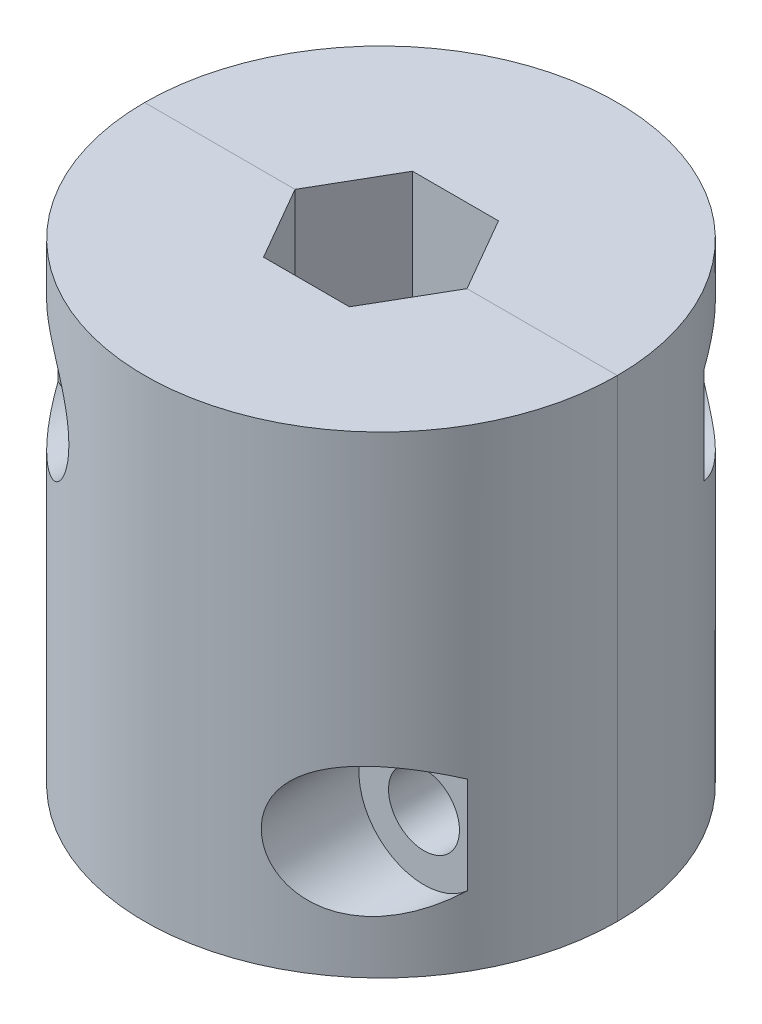
from build123d import *

# Parameters (mm, degrees)
BOSS_EXTRUDE1_DEPTH = 10
BOSS_EXTRUDE2_DEPTH = 10
SKETCH2_R           = 1.4999999999999998
CUT_EXTRUDE4_DEPTH  = 15
SKETCH2_5_R         = 2.75
SKETCH2_5_R_2       = 1.4999999999999998
CUT_EXTRUDE10_DEPTH = 5
CUT_EXTRUDE13_START = -20
SKETCH2_9_R         = 1.4999999999999998
CUT_EXTRUDE13_DEPTH = 15
CUT_EXTRUDE11_START = -20
SKETCH2_6_R         = 2.75
SKETCH2_6_R_2       = 1.4999999999999998
CUT_EXTRUDE11_DEPTH = 5
SKETCH1_5_W         = 20
SKETCH1_5_H         = 20
CUT_EXTRUDE9_DEPTH  = 10


with BuildPart() as part:
    # Sketch1 → Boss-Extrude1 (new, symmetric)
    with BuildSketch(Plane(origin=(0, 0, 0), x_dir=(1, 0, 0), z_dir=(0, 1, 0))):
        with BuildLine():
            Line((1.8186533479473221, 3.150000000000001), (3.6373066958946447, 0))
            Line((3.6373066958946447, 0), (10, 0))
            ThreePointArc((10, 0), (7.071067802431099, 7.0710678212998515), (-2.668444515e-08, 10))
            ThreePointArc((-2.668444515e-08, 10), (-7.071067821299852, 7.071067802431098), (-10, 1.22e-15))
            Line((-10, 0), (-3.637306695894643, 8.7e-16))
            Line((-3.637306695894643, 8.9e-16), (-1.8186533479473208, 3.1500000000000012))
            Line((-1.8186533479473206, 3.1500000000000012), (1.8186533479473224, 3.150000000000001))
        make_face()
        with BuildLine():
            ThreePointArc((-2.668444515e-08, 10), (7.071067802431099, 7.0710678212998515), (10, 0))
            Line((10, 0), (10, 10))
            Line((10, 10), (-2.668444488e-08, 10))
        make_face()
        with BuildLine():
            ThreePointArc((-10, 1.22e-15), (-7.071067821299852, 7.071067802431098), (-2.668444515e-08, 10))
            Line((-2.668444488e-08, 10), (-10, 10))
            Line((-10, 10), (-10, 0))
        make_face()
    extrude(amount=BOSS_EXTRUDE1_DEPTH, both=True)


with BuildPart() as body_2:
    # Sketch1<3> → Boss-Extrude2 (new, symmetric)
    with BuildSketch(Plane(origin=(0, 0, 0), x_dir=(1, 0, 0), z_dir=(0, 1, 0))):
        with BuildLine():
            Line((10, 0), (3.6373066958946447, 0))
            Line((3.6373066958946447, 0), (1.8186533479473237, -3.15))
            Line((1.8186533479473235, -3.15), (-1.8186533479473204, -3.15))
            Line((-1.8186533479473204, -3.15), (-3.637306695894643, 8.7e-16))
            Line((-3.637306695894643, 8.7e-16), (-10, 0))
            ThreePointArc((-10, 1.22e-15), (-7.071067811865477, -7.071067811865475), (-1.84e-15, -10))
            ThreePointArc((-1.84e-15, -10), (7.071067811865474, -7.071067811865477), (10, -2.45e-15))
        make_face()
        with BuildLine():
            Line((10, -10), (10, 0))
            ThreePointArc((10, -2.45e-15), (7.071067811865474, -7.071067811865477), (-1.84e-15, -10))
            Line((-1.78e-15, -10), (10, -10))
        make_face()
        with BuildLine():
            Line((-10, -10), (-1.78e-15, -10))
            ThreePointArc((-1.84e-15, -10), (-7.071067811865477, -7.071067811865475), (-10, 1.22e-15))
            Line((-10, 0), (-10, -10))
        make_face()
    extrude(amount=BOSS_EXTRUDE2_DEPTH, both=True)


with BuildPart() as cut_extrude4_tool:
    # Sketch2 → Cut-Extrude4 (new body)
    with BuildSketch(Plane(origin=(0, 0, -10), x_dir=(-1, 0, 0), z_dir=(0, 0, -1))):
        with Locations((-6.818653347947323, 5)):
            Circle(SKETCH2_R)
        with Locations((6.818653347947323, -5)):
            Circle(SKETCH2_R)
    extrude(amount=-CUT_EXTRUDE4_DEPTH)


with BuildPart() as part_1:
    add(part.part)

    # Cut-Extrude4: cut by cut_extrude4_tool
    add(cut_extrude4_tool.part, mode=Mode.SUBTRACT)

    # Sketch2<5> → Cut-Extrude10 (cut)
    # profile 1 of 2: a face of its own
    with BuildSketch(Plane(origin=(0, 0, -10), x_dir=(-1, 0, 0), z_dir=(0, 0, -1))):
        with Locations((-6.818653347947323, 5)):
            Circle(SKETCH2_5_R)
        with Locations((-6.818653347947323, 5)):
            Circle(SKETCH2_5_R_2, mode=Mode.SUBTRACT)
    # profile 2 of 2: a face of its own
    with BuildSketch(Plane(origin=(0, 0, -10), x_dir=(-1, 0, 0), z_dir=(0, 0, -1))):
        with Locations((6.818653347947323, -5)):
            Circle(SKETCH2_5_R)
        with Locations((6.818653347947323, -5)):
            Circle(SKETCH2_5_R_2, mode=Mode.SUBTRACT)
    extrude(amount=-CUT_EXTRUDE10_DEPTH, mode=Mode.SUBTRACT)


with BuildPart() as body_2_1:
    add(body_2.part)

    # Cut-Extrude4: cut by cut_extrude4_tool
    add(cut_extrude4_tool.part, mode=Mode.SUBTRACT)


with BuildPart() as cut_extrude13_tool:
    # Sketch2<9> → Cut-Extrude13 (new body)
    with BuildSketch(Plane(origin=(0, 0, -10), x_dir=(-1, 0, 0), z_dir=(0, 0, -1)).offset(CUT_EXTRUDE13_START)):
        with Locations(Location((6.818653347947323, 5, 0), (0, 0, 180))):
            Circle(SKETCH2_9_R)
        with Locations(Location((-6.818653347947323, -5, 0), (0, 0, 180))):
            Circle(SKETCH2_9_R)
    extrude(amount=CUT_EXTRUDE13_DEPTH)


with BuildPart() as part_2:
    add(part_1.part)

    # Cut-Extrude13: cut by cut_extrude13_tool
    add(cut_extrude13_tool.part, mode=Mode.SUBTRACT)


with BuildPart() as body_2_2:
    add(body_2_1.part)

    # Cut-Extrude13: cut by cut_extrude13_tool
    add(cut_extrude13_tool.part, mode=Mode.SUBTRACT)

    # Sketch2<6> → Cut-Extrude11 (cut)
    # profile 1 of 2: a face of its own
    with BuildSketch(Plane(origin=(0, 0, -10), x_dir=(-1, 0, 0), z_dir=(0, 0, -1)).offset(CUT_EXTRUDE11_START)):
        with Locations(Location((-6.818653347947323, -5, 0), (0, 0, 180))):
            Circle(SKETCH2_6_R)
        with Locations(Location((-6.818653347947323, -5, 0), (0, 0, 180))):
            Circle(SKETCH2_6_R_2, mode=Mode.SUBTRACT)
    # profile 2 of 2: a face of its own
    with BuildSketch(Plane(origin=(0, 0, -10), x_dir=(-1, 0, 0), z_dir=(0, 0, -1)).offset(CUT_EXTRUDE11_START)):
        with Locations(Location((6.818653347947323, 5, 0), (0, 0, 180))):
            Circle(SKETCH2_6_R)
        with Locations(Location((6.818653347947323, 5, 0), (0, 0, 180))):
            Circle(SKETCH2_6_R_2, mode=Mode.SUBTRACT)
    extrude(amount=CUT_EXTRUDE11_DEPTH, mode=Mode.SUBTRACT)


with BuildPart() as cut_extrude9_tool:
    # Sketch1<5> → Cut-Extrude9 (new, symmetric)
    # profile 1 of 5: a face of its own
    with BuildSketch(Plane(origin=(0, 0, 0), x_dir=(1, 0, 0), z_dir=(0, 1, 0))):
        Polygon((20, 20), (20, -19.999999999999996), (-19.999999999999996, -20), (-20, 20), align=None)
        Rectangle(SKETCH1_5_W, SKETCH1_5_H, mode=Mode.SUBTRACT)
    # profile 2 of 5: a face of its own
    with BuildSketch(Plane(origin=(0, 0, 0), x_dir=(1, 0, 0), z_dir=(0, 1, 0))):
        with BuildLine():
            ThreePointArc((-10, 1.22e-15), (-7.071067821299852, 7.071067802431098), (-2.668444515e-08, 10))
            Line((-2.668444488e-08, 10), (-10, 10))
            Line((-10, 10), (-10, 0))
        make_face()
    # profile 3 of 5: a face of its own
    with BuildSketch(Plane(origin=(0, 0, 0), x_dir=(1, 0, 0), z_dir=(0, 1, 0))):
        with BuildLine():
            ThreePointArc((-2.668444515e-08, 10), (7.071067802431099, 7.0710678212998515), (10, 0))
            Line((10, 0), (10, 10))
            Line((10, 10), (-2.668444488e-08, 10))
        make_face()
    # profile 4 of 5: a face of its own
    with BuildSketch(Plane(origin=(0, 0, 0), x_dir=(1, 0, 0), z_dir=(0, 1, 0))):
        with BuildLine():
            Line((10, -10), (10, 0))
            ThreePointArc((10, -2.45e-15), (7.071067811865474, -7.071067811865477), (-1.84e-15, -10))
            Line((-1.78e-15, -10), (10, -10))
        make_face()
    # profile 5 of 5: a face of its own
    with BuildSketch(Plane(origin=(0, 0, 0), x_dir=(1, 0, 0), z_dir=(0, 1, 0))):
        with BuildLine():
            Line((-10, -10), (-1.78e-15, -10))
            ThreePointArc((-1.84e-15, -10), (-7.071067811865477, -7.071067811865475), (-10, 1.22e-15))
            Line((-10, 0), (-10, -10))
        make_face()
    extrude(amount=CUT_EXTRUDE9_DEPTH, both=True)


with BuildPart() as part_3:
    add(part_2.part)

    # Cut-Extrude9: cut by cut_extrude9_tool
    add(cut_extrude9_tool.part, mode=Mode.SUBTRACT)


with BuildPart() as body_2_3:
    add(body_2_2.part)

    # Cut-Extrude9: cut by cut_extrude9_tool
    add(cut_extrude9_tool.part, mode=Mode.SUBTRACT)


solid = Compound([part_3.part, body_2_3.part])
